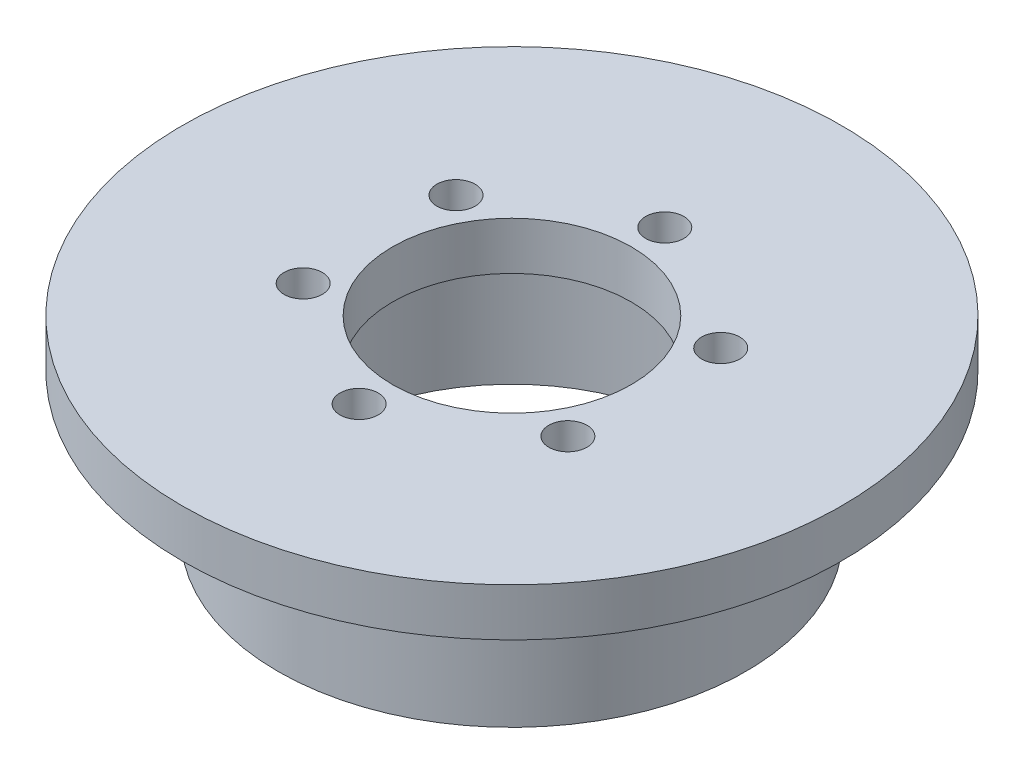
from build123d import *

# Parameters (mm, degrees)
CROQUIS1_R              = 34.5
SALIENTE_EXTRUIR1_DEPTH = 5
CROQUIS2_R              = 24.5
CROQUIS2_R_2            = 19.5
SALIENTE_EXTRUIR2_DEPTH = 15
CROQUIS5_R              = 12.5
CORTAR_EXTRUIR2_DEPTH   = 52.044098582
CROQUIS7_R              = 2
CORTAR_EXTRUIR3_DEPTH   = 52.044098582
MATRIZC1_COUNT          = 6


with BuildPart() as part:
    # Croquis1 → Saliente-Extruir1 (new body)
    with BuildSketch(Plane(origin=(0, 0, 0), x_dir=(1, 0, 0), z_dir=(0, 1, 0))):
        with Locations(Location((0, 0, 0), (0, 0, 270))):
            Circle(CROQUIS1_R)
    extrude(amount=SALIENTE_EXTRUIR1_DEPTH)

    # Croquis2 → Saliente-Extruir2 (add)
    with BuildSketch(Plane.XZ):
        with Locations(Location((0, 0, 0), (0, 0, 90))):
            Circle(CROQUIS2_R)
        with Locations(Location((0, 0, 0), (0, 0, 270))):
            Circle(CROQUIS2_R_2, mode=Mode.SUBTRACT)
    extrude(amount=SALIENTE_EXTRUIR2_DEPTH)

    # Croquis5 → Cortar-Extruir2 (cut, through all)
    with BuildSketch(Plane.XZ):
        with Locations(Location((0, 0, 0), (0, 0, 270))):
            Circle(CROQUIS5_R)
    extrude(amount=-CORTAR_EXTRUIR2_DEPTH, mode=Mode.SUBTRACT)

    # Croquis7 → Cortar-Extruir3 (cut, through all)
    with BuildSketch(Plane.XZ):
        with Locations(Location((0, -16, 0), (0, 0, 270))):
            Circle(CROQUIS7_R)
    cortar_extruir3 = extrude(amount=-CORTAR_EXTRUIR3_DEPTH, mode=Mode.SUBTRACT)

    # MatrizC1: Cortar-Extruir3 ×6 about axis
    matrizc1_axis = Axis((0, 0, 0), (0, 1, 0))
    for i in range(1, MATRIZC1_COUNT):
        add(cortar_extruir3.rotate(matrizc1_axis, i * 360 / MATRIZC1_COUNT), mode=Mode.SUBTRACT)


solid = part.part
